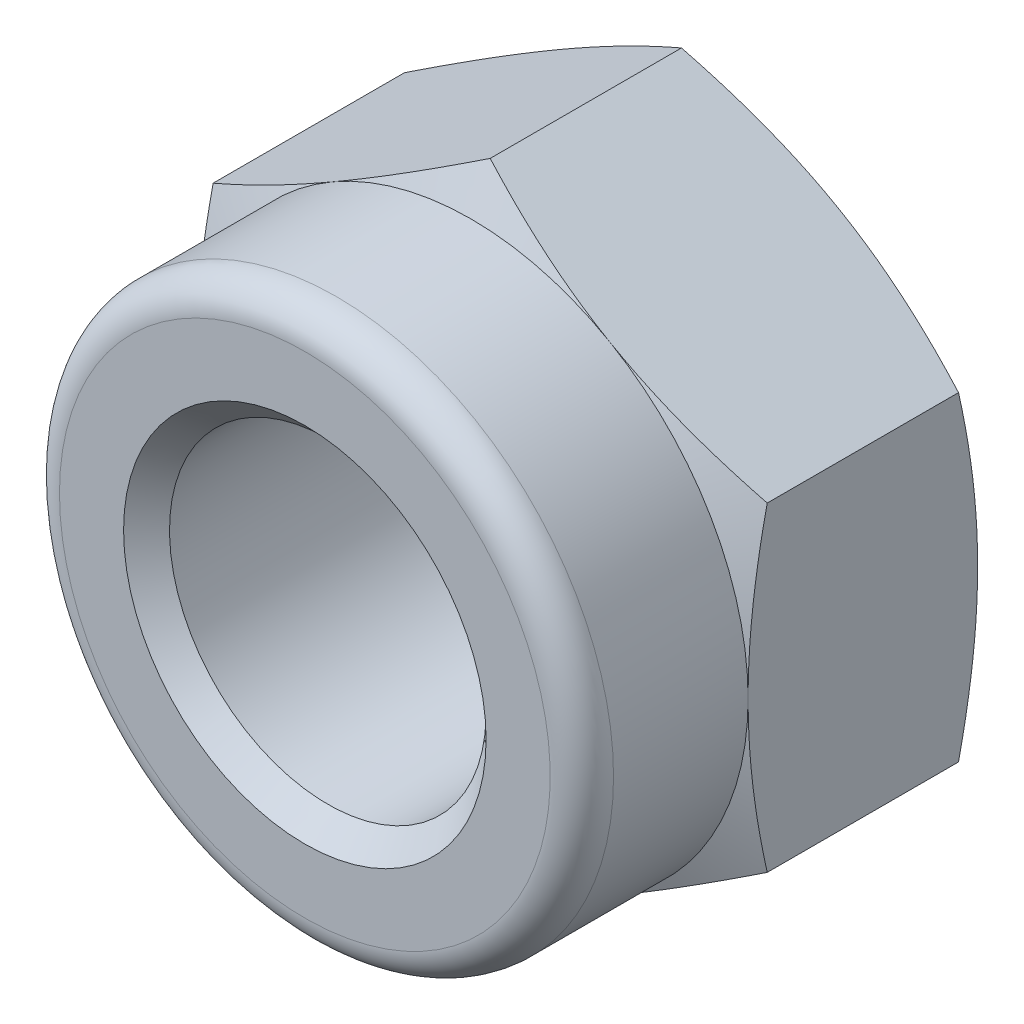
from build123d import *

# Parameters (mm, degrees)
SKETCH1_R           = 2
BOSS_EXTRUDE1_DEPTH = 2.9


with BuildPart() as part:
    # Sketch1 → Boss-Extrude1 (new body)
    with BuildSketch(Plane.XY):
        Polygon((0, -4.041451884), (3.5, -2.020725942), (3.5, 2.020725942), (0, 4.041451884), (-3.5, 2.020725942), (-3.5, -2.020725942), align=None)
        Circle(SKETCH1_R, mode=Mode.SUBTRACT)
    extrude(amount=BOSS_EXTRUDE1_DEPTH)

    # Sketch3 → Revolve1 (revolve)
    with BuildSketch(Plane(origin=(0, 0, 0), x_dir=(0, 0, -1), z_dir=(0, 1, 0))):
        with BuildLine():
            Line((-2.9, 3.5), (-4.6, 3.5))
            ThreePointArc((-4.6, 3.5), (-4.882842712, 3.382842712), (-5, 3.1))
            Line((-5, 3.1), (-5, 2))
            Line((-5, 2), (-2.9, 2))
            Line((-2.9, 2), (-2.9, 3.5))
        make_face()
    revolve(axis=Axis((0, 0, 0), (0, 0, 1)))

    # Sketch2 → Cut-Revolve1 (revolve, cut)
    with BuildSketch(Plane(origin=(0, 0, 0), x_dir=(0, 0, -1), z_dir=(1, 0, 0))):
        Polygon((-2.9, 4.041451884), (-2.9, 3.5), (-2.658333333, 4.041451884), align=None)
        Polygon((-0.241666667, 4.041451884), (0, 4.041451884), (0, 3.5), align=None)
        Polygon((-5, 2), (-4.71, 2), (-5, 2.29), align=None)
        Polygon((0, 2), (-0.29, 2), (0, 2.29), align=None)
    revolve(axis=Axis((0, 0, 0), (0, 0, 1)), mode=Mode.SUBTRACT)


solid = part.part
